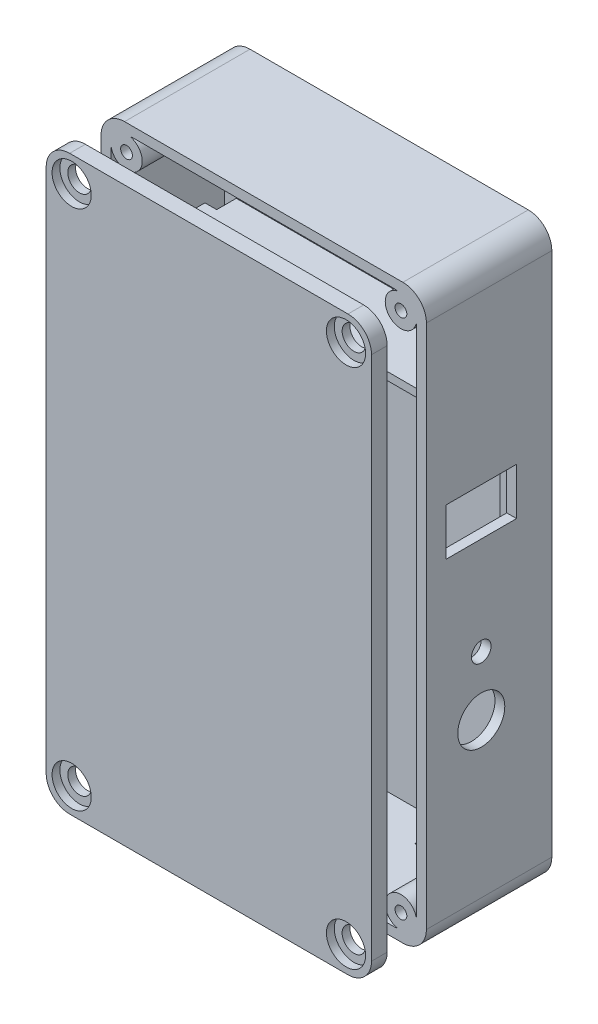
from build123d import *

# Parameters (mm, degrees)
BOX_BASE_DEPTH              = 3
BOX_WALLS_DEPTH             = 32
SCREW_PLATFORMS_DEPTH       = 32
BATTERY_START               = 10
BATTERY_COMPARTMENT_DEPTH   = 19
CUT_EXTRUDE1_DEPTH          = 3
CUT_EXTRUDE1_DEPTH_BACK     = 6
SKETCH5_W                   = 3
SKETCH5_H                   = 5
BOX_START                   = 10
SKETCH6_R                   = 5
BOX_COVER_DEPTH             = 4
BOSS_EXTRUDE11_START        = 10
SKETCH6_3_R                 = 5
SKETCH6_3_R_2               = 2.99754368
BOSS_EXTRUDE11_DEPTH        = 2
SKETCH8_W                   = 6
SKETCH8_H                   = 92.078446576
REST_PLATFORM_DEPTH         = 1.7
SKETCH9_R                   = 6
SKETCH9_R_2                 = 2.5
SKETCH9_W                   = 12
SKETCH9_H                   = 18
BUTTTON_HOLES_DEPTH         = 4
SKETCH10_W                  = 13
SKETCH10_H                  = 6
FAKE_USB_DEPTH              = 4
GPS_START                   = -10
SKETCH11_W                  = 29
SKETCH11_H                  = 29
GPS_ANTENNA_BOX_DEPTH       = 2
GPS_START_2                 = -12
GPS_ANTENNA_BOX_WALLS_DEPTH = 5
SKETCH12_W                  = 2
SKETCH12_H                  = 3
CUT_EXTRUDE4_DEPTH          = 4
SKETCH6_4_R                 = 1.5
CUT_EXTRUDE5_DEPTH          = 10


with BuildPart() as part:
    # Sketch2 → box base (new body)
    with BuildSketch(Plane(origin=(0, 0, 0), x_dir=(0, 1, 0), z_dir=(0, 0, 1))):
        with BuildLine():
            Line((2.5, 24.5), (2.5, 90.5))
            ThreePointArc((2.5, 90.5), (4.257359313, 94.742640687), (8.5, 96.5))
            Line((8.5, 96.5), (137.5, 96.5))
            ThreePointArc((137.5, 96.5), (141.742640687, 94.742640687), (143.5, 90.5))
            Line((143.5, 90.5), (143.5, 24.5))
            ThreePointArc((143.5, 24.5), (141.742640687, 20.257359313), (137.5, 18.5))
            Line((137.5, 18.5), (8.5, 18.5))
            ThreePointArc((8.5, 18.5), (4.257359313, 20.257359313), (2.5, 24.5))
        make_face()
    extrude(amount=BOX_BASE_DEPTH)

    # Sketch2<3> → box walls (add)
    with BuildSketch(Plane(origin=(0, 0, 0), x_dir=(0, 1, 0), z_dir=(0, 0, 1))):
        with BuildLine():
            Line((6, 16), (140, 16))
            ThreePointArc((140, 16), (144.242640687, 17.757359313), (146, 22))
            Line((146, 22), (146, 93))
            ThreePointArc((146, 93), (144.242640687, 97.242640687), (140, 99))
            Line((140, 99), (6, 99))
            ThreePointArc((6, 99), (1.757359313, 97.242640687), (0, 93))
            Line((0, 93), (0, 22))
            ThreePointArc((0, 22), (1.757359313, 17.757359313), (6, 16))
        make_face()
        with BuildLine():
            Line((2.5, 24.5), (2.5, 90.5))
            ThreePointArc((2.5, 90.5), (4.257359313, 94.742640687), (8.5, 96.5))
            Line((8.5, 96.5), (137.5, 96.5))
            ThreePointArc((137.5, 96.5), (141.742640687, 94.742640687), (143.5, 90.5))
            Line((143.5, 90.5), (143.5, 24.5))
            ThreePointArc((143.5, 24.5), (141.742640687, 20.257359313), (137.5, 18.5))
            Line((137.5, 18.5), (8.5, 18.5))
            ThreePointArc((8.5, 18.5), (4.257359313, 20.257359313), (2.5, 24.5))
        make_face(mode=Mode.SUBTRACT)
    extrude(amount=BOX_WALLS_DEPTH)

    # Sketch2<4> → screw platforms (add)
    with BuildSketch(Plane(origin=(0, 0, 0), x_dir=(0, 1, 0), z_dir=(0, 0, 1))):
        with BuildLine():
            ThreePointArc((7.397915762, 96.397915762), (4.257359313, 94.742640687), (2.602084238, 91.602084238))
            ThreePointArc((2.602084238, 91.602084238), (9.328427125, 89.671572875), (7.397915762, 96.397915762))
        make_face()
        with BuildLine():
            ThreePointArc((7.397915762, 18.602084238), (9.328427125, 25.328427125), (2.602084238, 23.397915762))
            ThreePointArc((2.602084238, 23.397915762), (4.257359313, 20.257359313), (7.397915762, 18.602084238))
        make_face()
        with BuildLine():
            ThreePointArc((143.397915762, 91.602084238), (141.742640687, 94.742640687), (138.602084238, 96.397915762))
            ThreePointArc((138.602084238, 96.397915762), (136.671572875, 89.671572875), (143.397915762, 91.602084238))
        make_face()
        with BuildLine():
            ThreePointArc((143.397915762, 23.397915762), (136.671572875, 25.328427125), (138.602084238, 18.602084238))
            ThreePointArc((138.602084238, 18.602084238), (141.742640687, 20.257359313), (143.397915762, 23.397915762))
        make_face()
    extrude(amount=SCREW_PLATFORMS_DEPTH)

    # Sketch3 → battery compartment (add)
    with BuildSketch(Plane(origin=(-67, 0, 32), x_dir=(0, -1, 0), z_dir=(0, 0, -1)).offset(BATTERY_START)):
        Polygon((-114.3, -45.238614765), (-114.3, -48.5), (-112.3, -48.5), (-112.3, 29.5), (-114.3, 29.5), align=None)
    extrude(amount=BATTERY_COMPARTMENT_DEPTH)

    # Sketch5 → Cut-Extrude1 (cut, two sides: drawn at the far end of the back side and taken through both)
    with BuildSketch(Plane.XZ.offset(-112.3).offset(-CUT_EXTRUDE1_DEPTH_BACK)):
        with Locations((-95, 5.5)):
            Rectangle(SKETCH5_W, SKETCH5_H)
        with Locations((-20, 5.5)):
            Rectangle(SKETCH5_W, SKETCH5_H)
    extrude(amount=CUT_EXTRUDE1_DEPTH + CUT_EXTRUDE1_DEPTH_BACK, mode=Mode.SUBTRACT)

    # Sketch8 → rest platform (add)
    with BuildSketch(Plane.XY.offset(3)):
        with Locations((-21.5, 57.339223288)):
            Rectangle(SKETCH8_W, SKETCH8_H)
        with Locations((-93.5, 57.339223288)):
            Rectangle(SKETCH8_W, SKETCH8_H)
    extrude(amount=REST_PLATFORM_DEPTH)

    # Sketch9 → buttton holes (cut)
    with BuildSketch(Plane.YZ.offset(-16)):
        with Locations(Location((45.3, 18, 0), (0, 0, 270))):
            Circle(SKETCH9_R)
        with Locations(Location((60.394515887, 18, 0), (0, 0, 270))):
            Circle(SKETCH9_R_2)
        with Locations((91.3, 18)):
            Rectangle(SKETCH9_W, SKETCH9_H)
    extrude(amount=-BUTTTON_HOLES_DEPTH, mode=Mode.SUBTRACT)

    # Sketch10 → fake usb (cut)
    with BuildSketch(Plane.XZ):
        with Locations((-33.442978121, 8)):
            Rectangle(SKETCH10_W, SKETCH10_H)
    extrude(amount=-FAKE_USB_DEPTH, mode=Mode.SUBTRACT)

    # Sketch11 → gps antenna box (add)
    with BuildSketch(Plane.XY.offset(32).offset(GPS_START)):
        with Locations((-82, 97.8)):
            Rectangle(SKETCH11_W, SKETCH11_H)
    extrude(amount=-GPS_ANTENNA_BOX_DEPTH)

    # Sketch11<4> → gps antenna box walls (add)
    with BuildSketch(Plane.XY.offset(32).offset(GPS_START_2)):
        Polygon((-96.5, 114.3), (-96.5, 112.3), (-67.5, 112.3), (-67.5, 83.3), (-96.5, 83.3), (-96.5, 81.3), (-65.5, 81.3), (-65.5, 112.3), (-65.5, 114.3), (-67.5, 114.3), align=None)
    extrude(amount=GPS_ANTENNA_BOX_WALLS_DEPTH)

    # Sketch12 → Cut-Extrude4 (cut)
    with BuildSketch(Plane.XZ.offset(-81.3)):
        with Locations((-81, 23.5)):
            Rectangle(SKETCH12_W, SKETCH12_H)
    extrude(amount=-CUT_EXTRUDE4_DEPTH, mode=Mode.SUBTRACT)

    # Sketch6<4> → Cut-Extrude5 (cut)
    with BuildSketch(Plane.XY.offset(32)):
        with Locations((-92.5, 139.5)):
            Circle(SKETCH6_4_R)
        with Locations((-22.5, 139.5)):
            Circle(SKETCH6_4_R)
        with Locations((-22.5, 6.5)):
            Circle(SKETCH6_4_R)
        with Locations((-92.5, 6.5)):
            Circle(SKETCH6_4_R)
    extrude(amount=-CUT_EXTRUDE5_DEPTH, mode=Mode.SUBTRACT)


with BuildPart() as body_2:
    # Sketch6 → box cover (new body)
    with BuildSketch(Plane.XY.offset(32).offset(BOX_START)):
        with BuildLine():
            Line((-16, 6), (-16, 140))
            ThreePointArc((-16, 140), (-17.757359313, 144.242640687), (-22, 146))
            Line((-22, 146), (-93, 146))
            ThreePointArc((-93, 146), (-97.242640687, 144.242640687), (-99, 140))
            Line((-99, 140), (-99, 6))
            ThreePointArc((-99, 6), (-97.242640687, 1.757359313), (-93, 0))
            Line((-93, 0), (-22, 0))
            ThreePointArc((-22, 0), (-17.757359313, 1.757359313), (-16, 6))
        make_face()
        with Locations((-92.5, 139.5)):
            Circle(SKETCH6_R, mode=Mode.SUBTRACT)
        with Locations((-22.5, 139.5)):
            Circle(SKETCH6_R, mode=Mode.SUBTRACT)
        with Locations((-22.5, 6.5)):
            Circle(SKETCH6_R, mode=Mode.SUBTRACT)
        with Locations((-92.5, 6.5)):
            Circle(SKETCH6_R, mode=Mode.SUBTRACT)
    extrude(amount=BOX_COVER_DEPTH)

    # Sketch6<3> → Boss-Extrude11 (add)
    # profile 1 of 4: a face of its own
    with BuildSketch(Plane.XY.offset(32).offset(BOSS_EXTRUDE11_START)):
        with Locations((-22.5, 139.5)):
            Circle(SKETCH6_3_R)
        with Locations((-22.5, 139.5)):
            Circle(SKETCH6_3_R_2, mode=Mode.SUBTRACT)
    # profile 2 of 4: a face of its own
    with BuildSketch(Plane.XY.offset(32).offset(BOSS_EXTRUDE11_START)):
        with Locations((-92.5, 139.5)):
            Circle(SKETCH6_3_R)
        with Locations((-92.5, 139.5)):
            Circle(SKETCH6_3_R_2, mode=Mode.SUBTRACT)
    # profile 3 of 4: a face of its own
    with BuildSketch(Plane.XY.offset(32).offset(BOSS_EXTRUDE11_START)):
        with Locations((-22.5, 6.5)):
            Circle(SKETCH6_3_R)
        with Locations((-22.5, 6.5)):
            Circle(SKETCH6_3_R_2, mode=Mode.SUBTRACT)
    # profile 4 of 4: a face of its own
    with BuildSketch(Plane.XY.offset(32).offset(BOSS_EXTRUDE11_START)):
        with Locations((-92.5, 6.5)):
            Circle(SKETCH6_3_R)
        with Locations((-92.5, 6.5)):
            Circle(SKETCH6_3_R_2, mode=Mode.SUBTRACT)
    extrude(amount=BOSS_EXTRUDE11_DEPTH)


solid = Compound([part.part, body_2.part])
